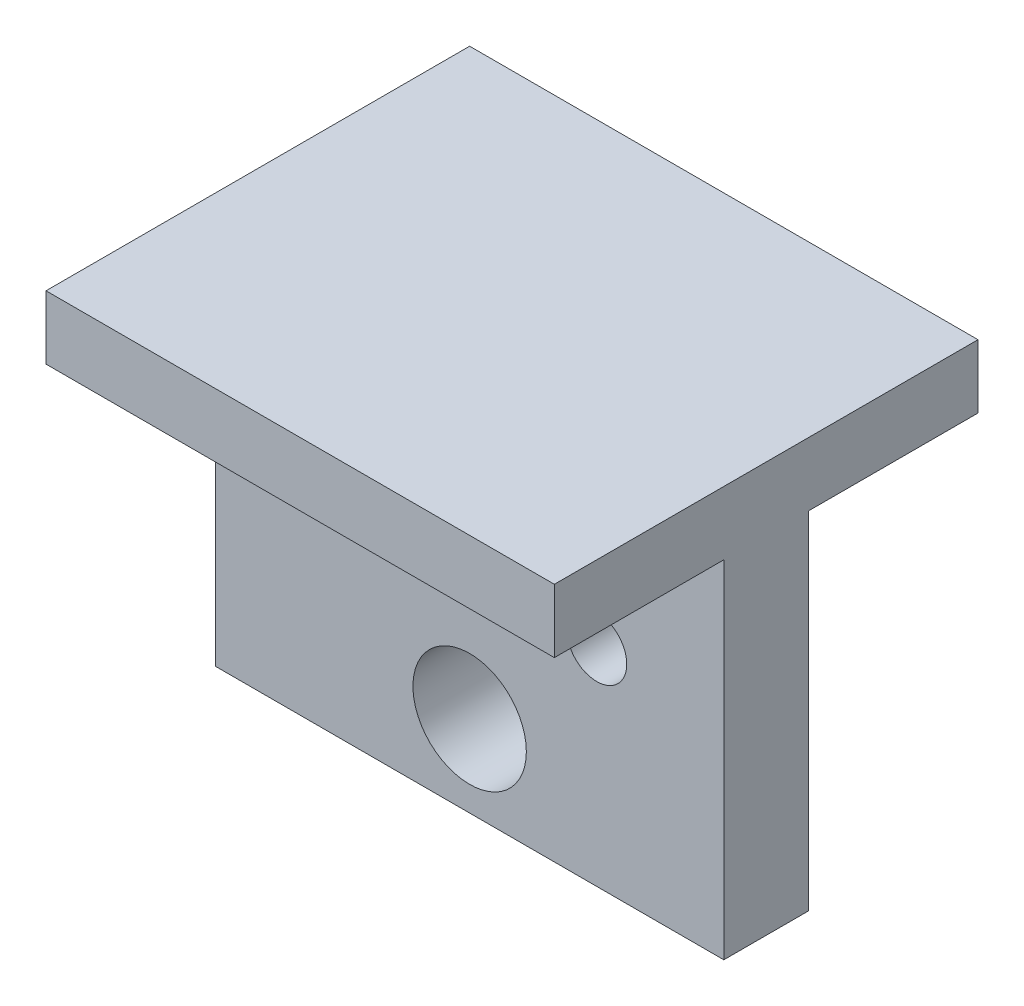
from build123d import *

# Parameters (mm, degrees)
SKETCH1_W           = 76.2
SKETCH1_H           = 9.523545078
BOSS_EXTRUDE2_DEPTH = 31.75
SKETCH1_6_R         = 8.5
SKETCH1_6_R_2       = 4.5
BOSS_EXTRUDE3_DEPTH = 6.35


with BuildPart() as part:
    # Sketch1 → Boss-Extrude2 (new, symmetric)
    with BuildSketch(Plane.XY):
        with Locations((0, 44.46410331)):
            Rectangle(SKETCH1_W, SKETCH1_H)
    extrude(amount=BOSS_EXTRUDE2_DEPTH, both=True)

    # Sketch1<6> → Boss-Extrude3 (add, symmetric)
    with BuildSketch(Plane.XY):
        Polygon((-38.1, -12.224), (38.1, -12.224), (38.1, 12.224), (38.1, 39.702330771), (-38.1, 39.702330771), (-38.1, 12.224), align=None)
        Circle(SKETCH1_6_R, mode=Mode.SUBTRACT)
        with Locations((-19.05, 18.874330771)):
            Circle(SKETCH1_6_R_2, mode=Mode.SUBTRACT)
        with Locations((19.05, 18.874330771)):
            Circle(SKETCH1_6_R_2, mode=Mode.SUBTRACT)
    extrude(amount=BOSS_EXTRUDE3_DEPTH, both=True)


solid = part.part
